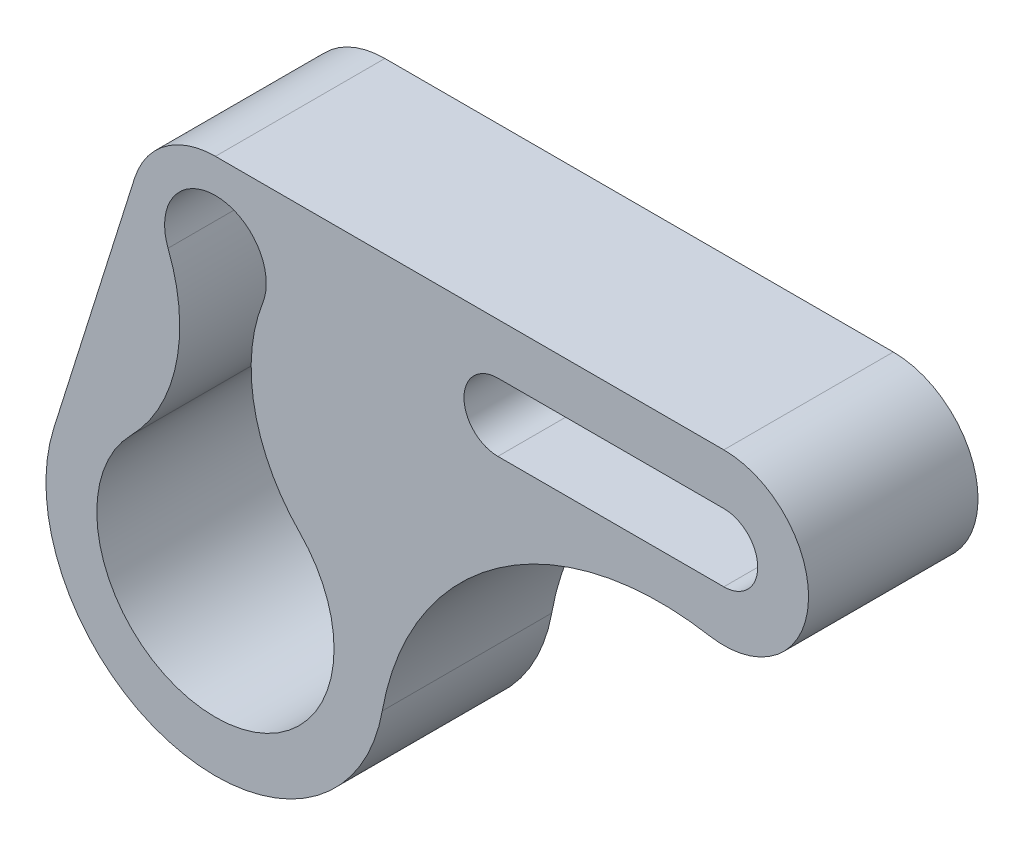
from build123d import *

# Parameters (mm, degrees)
BOSS_EXTRUDE1_DEPTH = 15


with BuildPart() as part:
    # Sketch1 → Boss-Extrude1 (new, symmetric)
    with BuildSketch(Plane.XY):
        with BuildLine():
            Line((90, 65), (0, 65))
            ThreePointArc((0, 65), (-8.874119675, 62.093386622), (-14.309088021, 54.5))
            Line((-14.309088021, 54.5), (-28.618176043, 9))
            ThreePointArc((-28.618176043, 9), (-7.143700144, -29.137047693), (29.535645594, -5.25791207))
            ThreePointArc((29.535645594, -5.25791207), (50.100874494, 26.949083525), (87.406551135, 35.225900265))
            ThreePointArc((87.406551135, 35.225900265), (104.943418217, 48.698365648), (90, 65))
        make_face()
        with BuildLine():
            Line((50, 56), (90, 56))
            ThreePointArc((90, 56), (96, 50), (90, 44))
            Line((90, 44), (50, 44))
            ThreePointArc((50, 44), (44, 50), (50, 56))
        make_face(mode=Mode.SUBTRACT)
        with BuildLine():
            ThreePointArc((-14.956527547, 14.741176471), (0, -21), (14.956527547, 14.741176471))
            ThreePointArc((14.956527547, 14.741176471), (6.937432482, 29.759413292), (8.382229724, 46.723076923))
            ThreePointArc((8.382229724, 46.723076923), (0, 59), (-8.382229724, 46.723076923))
            ThreePointArc((-8.382229724, 46.723076923), (-6.937432482, 29.759413292), (-14.956527547, 14.741176471))
        make_face(mode=Mode.SUBTRACT)
    extrude(amount=BOSS_EXTRUDE1_DEPTH, both=True)


solid = part.part
